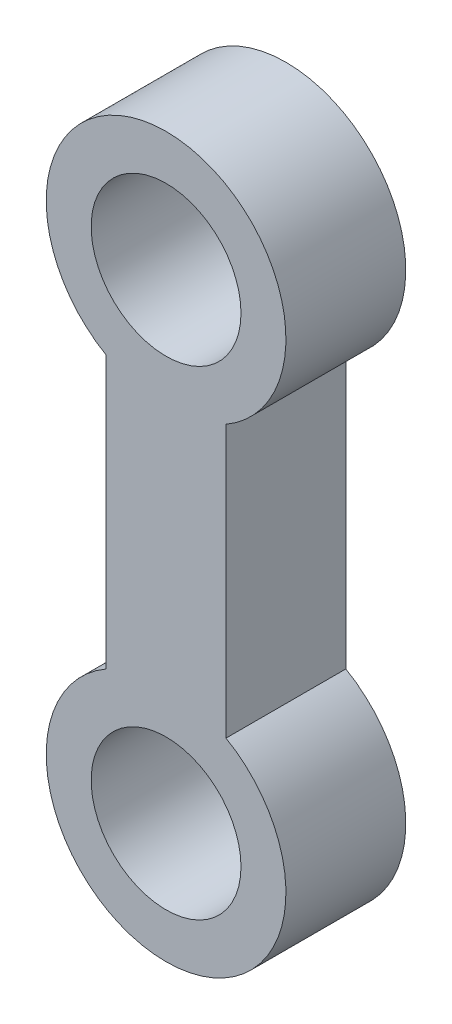
from build123d import *

# Parameters (mm, degrees)
BOSS_EXTRUDE1_DEPTH = 10
SKETCH2_R           = 6.25
CUT_EXTRUDE1_DEPTH  = 52.961524227


with BuildPart() as part:
    # Sketch1 → Boss-Extrude1 (new body)
    with BuildSketch(Plane.XY):
        with BuildLine():
            Line((0, 40), (0, 30))
            ThreePointArc((0, 30), (2.588190451, 30.340741737), (5, 31.339745962))
            Line((5, 31.339745962), (5, 40))
            Line((5, 40), (0, 40))
        make_face()
        with BuildLine():
            Line((0, 50), (0, 40))
            Line((0, 40), (5, 40))
            Line((5, 40), (5, 31.339745962))
            ThreePointArc((5, 31.339745962), (8.660254038, 35), (10, 40))
            ThreePointArc((10, 40), (7.071067812, 47.071067812), (0, 50))
        make_face()
        with BuildLine():
            ThreePointArc((-5, 31.339745962), (-2.588190451, 30.340741737), (0, 30))
            Line((0, 30), (0, 40))
            Line((0, 40), (-5, 40))
            Line((-5, 40), (-5, 31.339745962))
        make_face()
        with BuildLine():
            Line((-5, 40), (0, 40))
            Line((0, 40), (0, 50))
            ThreePointArc((0, 50), (-9.659258263, 42.588190451), (-5, 31.339745962))
            Line((-5, 31.339745962), (-5, 40))
        make_face()
        with BuildLine():
            Line((0, 30), (0, 10))
            ThreePointArc((0, 10), (2.588190451, 9.659258263), (5, 8.660254038))
            Line((5, 8.660254038), (5, 31.339745962))
            ThreePointArc((5, 31.339745962), (2.588190451, 30.340741737), (0, 30))
        make_face()
        with BuildLine():
            ThreePointArc((-5, 8.660254038), (-2.588190451, 9.659258263), (0, 10))
            Line((0, 10), (0, 30))
            ThreePointArc((0, 30), (-2.588190451, 30.340741737), (-5, 31.339745962))
            Line((-5, 31.339745962), (-5, 8.660254038))
        make_face()
        with BuildLine():
            Line((-5, 0), (0, 0))
            Line((0, 0), (0, 10))
            ThreePointArc((0, 10), (-2.588190451, 9.659258263), (-5, 8.660254038))
            Line((-5, 8.660254038), (-5, 0))
        make_face()
        with BuildLine():
            Line((0, 10), (0, 0))
            Line((0, 0), (5, 0))
            Line((5, 0), (5, 8.660254038))
            ThreePointArc((5, 8.660254038), (2.588190451, 9.659258263), (0, 10))
        make_face()
        with BuildLine():
            Line((5, 0), (0, 0))
            Line((0, 0), (-5, 0))
            Line((-5, 0), (-5, 8.660254038))
            ThreePointArc((-5, 8.660254038), (-5, -8.660254038), (10, 0))
            ThreePointArc((10, 0), (8.660254038, 5), (5, 8.660254038))
            Line((5, 8.660254038), (5, 0))
        make_face()
    extrude(amount=BOSS_EXTRUDE1_DEPTH)

    # Sketch2 → Cut-Extrude1 (cut, through all)
    with BuildSketch(Plane.XY.offset(10)):
        with Locations((0, 40)):
            Circle(SKETCH2_R)
        Circle(SKETCH2_R)
    extrude(amount=-CUT_EXTRUDE1_DEPTH, mode=Mode.SUBTRACT)


solid = part.part
